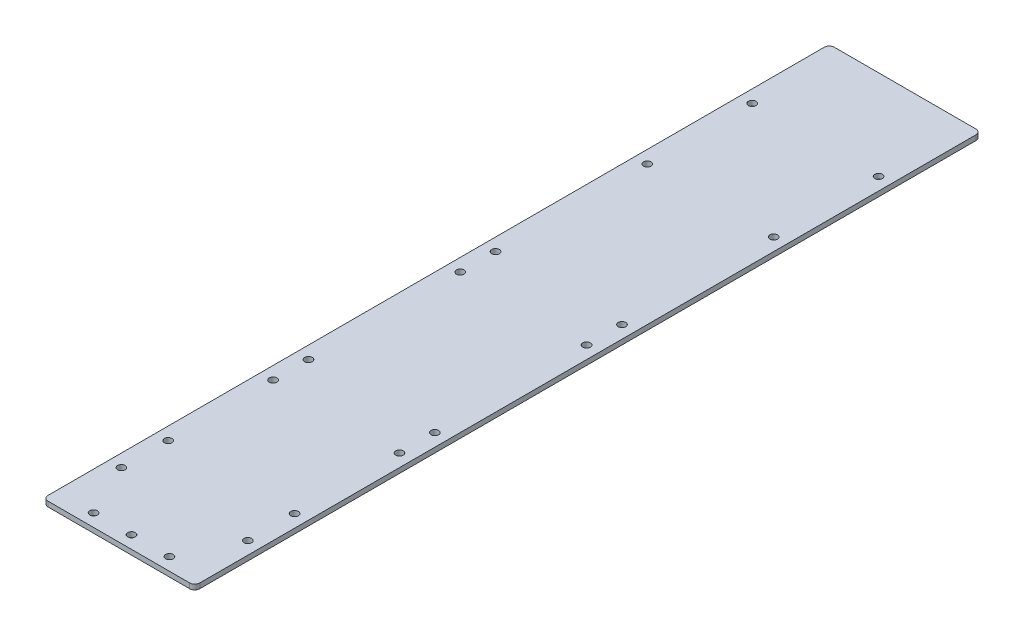
from build123d import *

# Parameters (mm, degrees)
SKETCH_1_W             = 60
SKETCH_1_H             = 311
EXTRUDE_892_DEPTH      = 2
SKETCH_5_R             = 1.5
CUT_EXTRUDE_1272_DEPTH = 179.549712965
SKETCH_3_R             = 1.5
CUT_EXTRUDE_1780_DEPTH = 179.549712965
SKETCH_8_R             = 1.5
CUT_EXTRUDE_2158_DEPTH = 179.549712965
FILLET_1_R             = 2


with BuildPart() as part:
    # эскиз 1 → Extrude 892 (new body)
    with BuildSketch(Plane(origin=(0, 0, 0), x_dir=(1, 0, 0), z_dir=(0, 1, 0))):
        with Locations((0, 20.5)):
            Rectangle(SKETCH_1_W, SKETCH_1_H)
    extrude(amount=EXTRUDE_892_DEPTH)

    # Эскиз5 → Cut-Extrude 1272 (cut, through all)
    with BuildSketch(Plane(origin=(0, 2, 0), x_dir=(1, 0, 0), z_dir=(0, 1, 0))):
        with Locations(Location((-25, 99, 0), (0, 0, 270))):
            Circle(SKETCH_5_R)
        with Locations(Location((25, 99, 0), (0, 0, 270))):
            Circle(SKETCH_5_R)
        with Locations(Location((25, 39, 0), (0, 0, 270))):
            Circle(SKETCH_5_R)
        with Locations(Location((-25, 39, 0), (0, 0, 270))):
            Circle(SKETCH_5_R)
        with Locations(Location((-25, 25, 0), (0, 0, 270))):
            Circle(SKETCH_5_R)
        with Locations(Location((25, 25, 0), (0, 0, 270))):
            Circle(SKETCH_5_R)
        with Locations(Location((-25, -35, 0), (0, 0, 270))):
            Circle(SKETCH_5_R)
        with Locations(Location((25, -35, 0), (0, 0, 270))):
            Circle(SKETCH_5_R)
        with Locations(Location((25, -49, 0), (0, 0, 270))):
            Circle(SKETCH_5_R)
        with Locations(Location((-25, -49, 0), (0, 0, 270))):
            Circle(SKETCH_5_R)
        with Locations(Location((25, -109, 0), (0, 0, 270))):
            Circle(SKETCH_5_R)
        with Locations(Location((-25, -109, 0), (0, 0, 270))):
            Circle(SKETCH_5_R)
    extrude(amount=-CUT_EXTRUDE_1272_DEPTH, mode=Mode.SUBTRACT)

    # эскиз 3 → Cut-Extrude 1780 (cut, through all)
    with BuildSketch(Plane(origin=(0, 2, 0), x_dir=(1, 0, 0), z_dir=(0, 1, 0))):
        with Locations(Location((-25, -90.5, 0), (0, 0, 270))):
            Circle(SKETCH_3_R)
        with Locations(Location((25, -90.5, 0), (0, 0, 270))):
            Circle(SKETCH_3_R)
        with Locations(Location((-25, 140.5, 0), (0, 0, 270))):
            Circle(SKETCH_3_R)
        with Locations(Location((25, 140.5, 0), (0, 0, 270))):
            Circle(SKETCH_3_R)
    extrude(amount=-CUT_EXTRUDE_1780_DEPTH, mode=Mode.SUBTRACT)

    # Эскиз8 → Cut-Extrude 2158 (cut, through all)
    with BuildSketch(Plane(origin=(0, 2, 0), x_dir=(1, 0, 0), z_dir=(0, 1, 0))):
        with Locations(Location((-15, -130, 0), (0, 0, 270))):
            Circle(SKETCH_8_R)
        with Locations(Location((15, -130, 0), (0, 0, 270))):
            Circle(SKETCH_8_R)
        with Locations(Location((0, -130, 0), (0, 0, 270))):
            Circle(SKETCH_8_R)
    extrude(amount=-CUT_EXTRUDE_2158_DEPTH, mode=Mode.SUBTRACT)

    # Скругление1
    fillet_1_edges = [part.edges().sort_by_distance(p)[0] for p in [
        (-30, 1, -176),
        (30, 1, -176),
        (30, 1, 135),
        (-30, 1, 135),
    ]]
    fillet(fillet_1_edges, radius=FILLET_1_R)


solid = part.part
